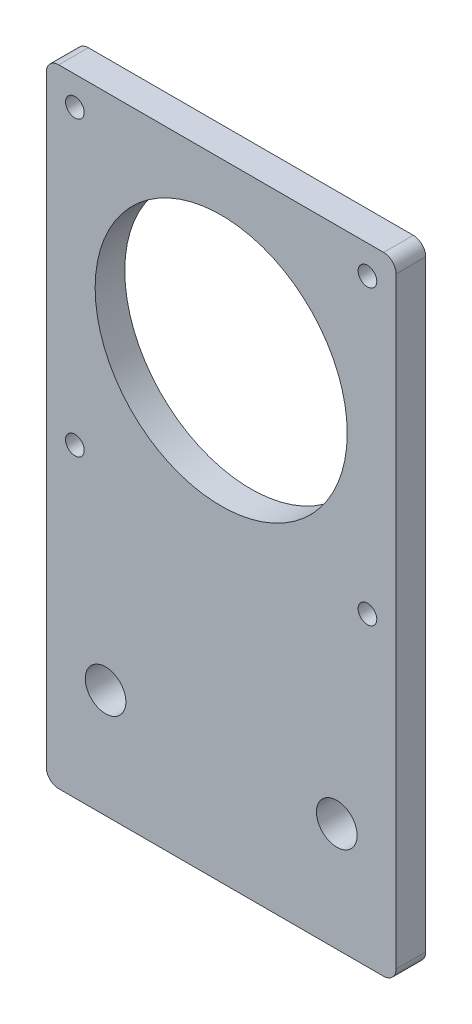
from build123d import *

# Parameters (mm, degrees)
SKETCH1_W           = 56.2
SKETCH1_H           = 100.725
BOSS_EXTRUDE1_DEPTH = 2.38125
SKETCH2_R           = 20.25
SKETCH2_R_2         = 1.5
SKETCH2_R_3         = 3.2639
CUT_EXTRUDE1_DEPTH  = 58.867718224
FILLET1_R           = 2


with BuildPart() as part:
    # Sketch1 → Boss-Extrude1 (new, symmetric)
    with BuildSketch(Plane.XY):
        Rectangle(SKETCH1_W, SKETCH1_H)
    extrude(amount=BOSS_EXTRUDE1_DEPTH, both=True)

    # Sketch2 → Cut-Extrude1 (cut, through all)
    with BuildSketch(Plane.XY.offset(2.38125)):
        with Locations((0, 22.2625)):
            Circle(SKETCH2_R)
        with Locations((-23.5, 45.7625)):
            Circle(SKETCH2_R_2)
        with Locations((23.5, 45.7625)):
            Circle(SKETCH2_R_2)
        with Locations((-23.5, -1.2375)):
            Circle(SKETCH2_R_2)
        with Locations((23.5, -1.2375)):
            Circle(SKETCH2_R_2)
        with Locations((-18.575, -32.9)):
            Circle(SKETCH2_R_3)
        with Locations((18.575, -32.9)):
            Circle(SKETCH2_R_3)
    extrude(amount=-CUT_EXTRUDE1_DEPTH, mode=Mode.SUBTRACT)

    # Fillet1
    fillet1_edges = [part.edges().sort_by_distance(p)[0] for p in [
        (28.1, -50.3625, 0),
        (-28.1, -50.3625, 0),
        (-28.1, 50.3625, 0),
        (28.1, 50.3625, 0),
    ]]
    fillet(fillet1_edges, radius=FILLET1_R)


solid = part.part
